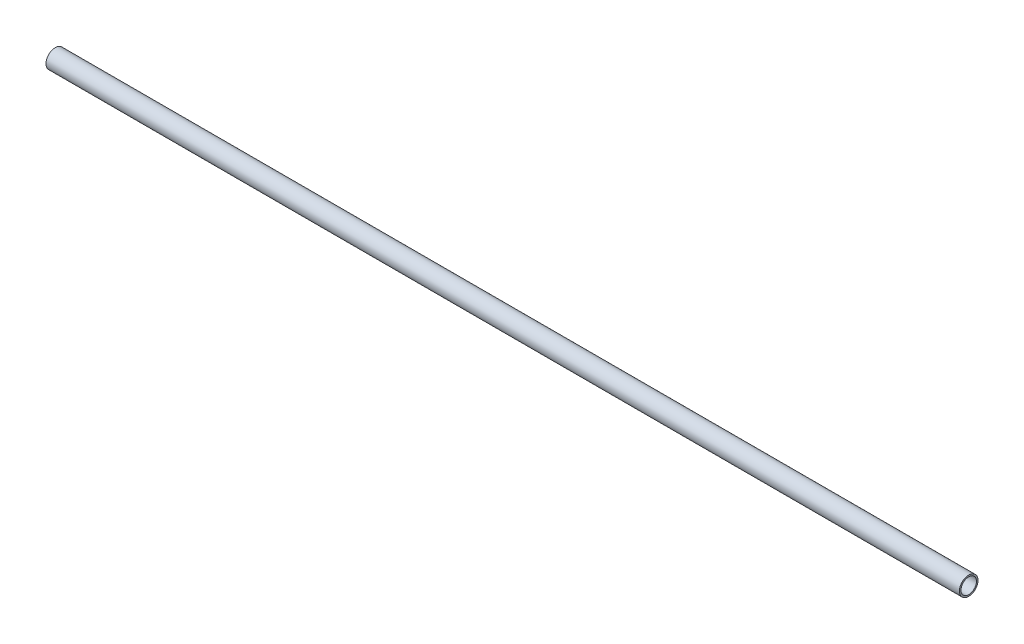
from build123d import *

# Parameters (mm, degrees)
SKETCH1_R           = 0.9144
SKETCH1_R_2         = 0.762
BOSS_EXTRUDE1_DEPTH = 90
SKETCH3_R           = 0.396875
CUT_EXTRUDE2_DEPTH  = 10


with BuildPart() as part:
    # Sketch1 → Boss-Extrude1 (new body)
    with BuildSketch(Plane(origin=(0, 0, 0), x_dir=(0, 0, -1), z_dir=(1, 0, 0))):
        Circle(SKETCH1_R)
        Circle(SKETCH1_R_2, mode=Mode.SUBTRACT)
    extrude(amount=BOSS_EXTRUDE1_DEPTH)

    # Sketch3 → Cut-Extrude2 (cut)
    with BuildSketch(Plane.XY):
        with Locations((0.798611036, 0)):
            Circle(SKETCH3_R)
    extrude(amount=-CUT_EXTRUDE2_DEPTH, mode=Mode.SUBTRACT)


solid = part.part
